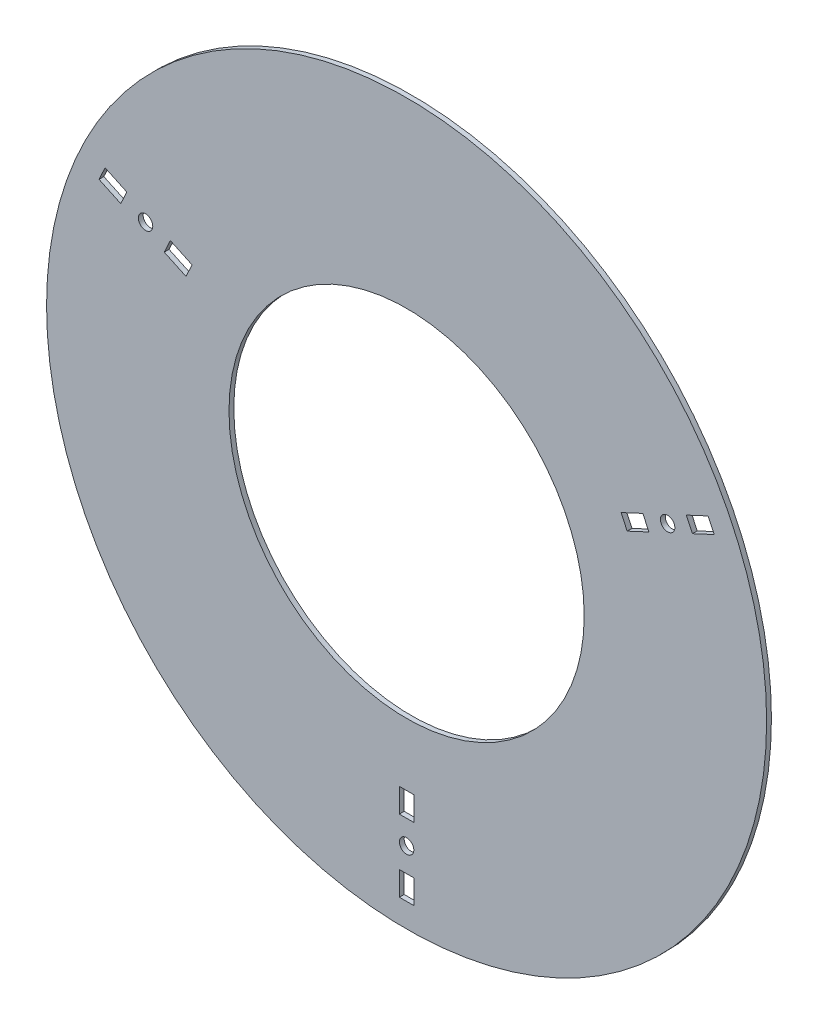
from build123d import *

# Parameters (mm, degrees)
SKETCH1_R           = 75
SKETCH1_R_2         = 37
SKETCH1_R_3         = 1.5
SKETCH1_W           = 3
SKETCH1_H           = 5
BOSS_EXTRUDE1_DEPTH = 1


with BuildPart() as part:
    # Sketch1 → Boss-Extrude1 (new body)
    with BuildSketch(Plane.XY):
        Circle(SKETCH1_R)
        Circle(SKETCH1_R_2, mode=Mode.SUBTRACT)
        with Locations((0, -60)):
            Circle(SKETCH1_R_3, mode=Mode.SUBTRACT)
        with Locations((54.378467222, 25.357095704)):
            Circle(SKETCH1_R_3, mode=Mode.SUBTRACT)
        with Locations((-54.378467222, 25.357095704)):
            Circle(SKETCH1_R_3, mode=Mode.SUBTRACT)
        with Locations((0, -52.5)):
            Rectangle(SKETCH1_W, SKETCH1_H, mode=Mode.SUBTRACT)
        with Locations((0, -67.5)):
            Rectangle(SKETCH1_W, SKETCH1_H, mode=Mode.SUBTRACT)
        Polygon((49.213000894, 24.603466076), (44.681461959, 22.490374768), (45.949316744, 19.771451406), (50.48085568, 21.884542715), align=None, mode=Mode.SUBTRACT)
        Polygon((58.276078765, 28.829648694), (62.8076177, 30.942740002), (64.075472485, 28.223816641), (59.54393355, 26.110725333), align=None, mode=Mode.SUBTRACT)
        Polygon((-58.276078765, 28.829648694), (-62.8076177, 30.942740002), (-64.075472485, 28.223816641), (-59.54393355, 26.110725333), align=None, mode=Mode.SUBTRACT)
        Polygon((-49.213000894, 24.603466076), (-44.681461959, 22.490374768), (-45.949316744, 19.771451406), (-50.48085568, 21.884542715), align=None, mode=Mode.SUBTRACT)
    extrude(amount=BOSS_EXTRUDE1_DEPTH)


solid = part.part
